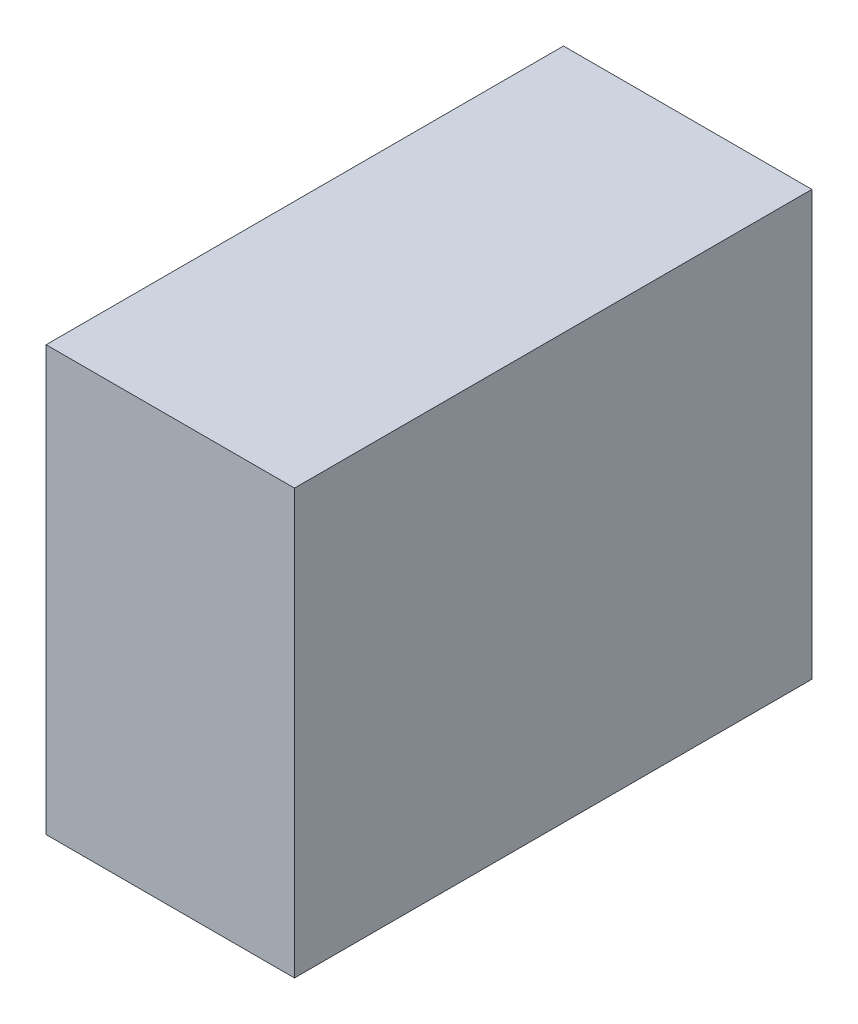
from build123d import *

# Parameters (mm, degrees)
SKETCH1_W           = 304.8
SKETCH1_H           = 635
BOSS_EXTRUDE1_DEPTH = 520.7


with BuildPart() as part:
    # Sketch1 → Boss-Extrude1 (new body)
    with BuildSketch(Plane(origin=(0, 0, 0), x_dir=(1, 0, 0), z_dir=(0, 1, 0))):
        with Locations((152.4, 317.5)):
            Rectangle(SKETCH1_W, SKETCH1_H)
    extrude(amount=BOSS_EXTRUDE1_DEPTH)


solid = part.part
